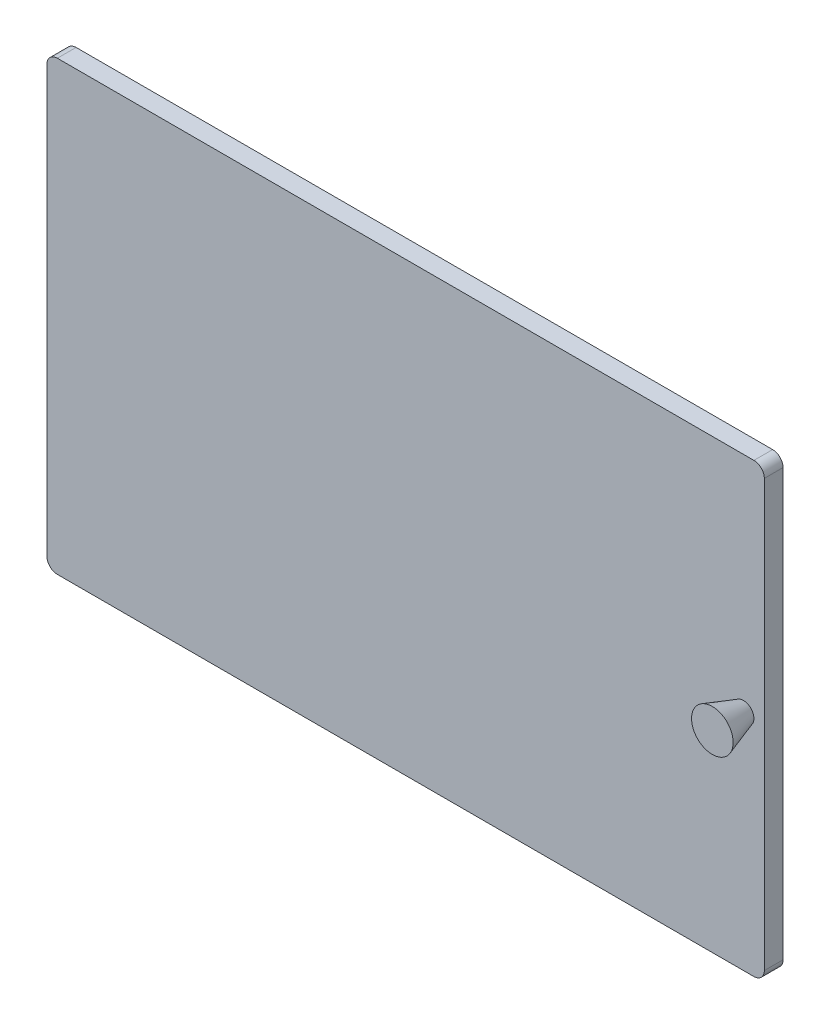
from build123d import *

# Parameters (mm, degrees)
BOSS_EXTRUDE1_DEPTH = 1.8
SKETCH2_R           = 1
BOSS_EXTRUDE2_DEPTH = 3
BOSS_EXTRUDE2_DRAFT = -18.434


with BuildPart() as part:
    # Sketch1 → Boss-Extrude1 (new body)
    with BuildSketch(Plane.XY):
        with BuildLine():
            Line((-33.5, -21.5), (33.5, -21.5))
            ThreePointArc((33.5, -21.5), (34.207106781, -21.207106781), (34.5, -20.5))
            Line((34.5, -20.5), (34.5, 20.5))
            ThreePointArc((34.5, 20.5), (34.207106781, 21.207106781), (33.5, 21.5))
            Line((33.5, 21.5), (-33.5, 21.5))
            ThreePointArc((-33.5, 21.5), (-34.207106781, 21.207106781), (-34.5, 20.5))
            Line((-34.5, 20.5), (-34.5, -20.5))
            ThreePointArc((-34.5, -20.5), (-34.207106781, -21.207106781), (-33.5, -21.5))
        make_face()
    extrude(amount=BOSS_EXTRUDE1_DEPTH)


with BuildPart() as boss_extrude2_tool:
    # Sketch2 → Boss-Extrude2 (with draft: the straight prism first)
    with BuildSketch(Plane.XY.offset(1.8)):
        with Locations((32.5, 0)):
            Circle(SKETCH2_R)
    extrude(amount=BOSS_EXTRUDE2_DEPTH)
    # Boss-Extrude2: the draft: its side faces are tilted about the plane it starts from
    boss_extrude2_sides = [boss_extrude2_tool.faces().sort_by_distance(p)[0] for p in [
        (31.5, 0, 3.3),
    ]]
    draft(boss_extrude2_sides, Plane.XY.offset(1.8), BOSS_EXTRUDE2_DRAFT)


with BuildPart() as part_1:
    add(part.part)

    # Boss-Extrude2: add boss_extrude2_tool
    add(boss_extrude2_tool.part)


solid = part_1.part
